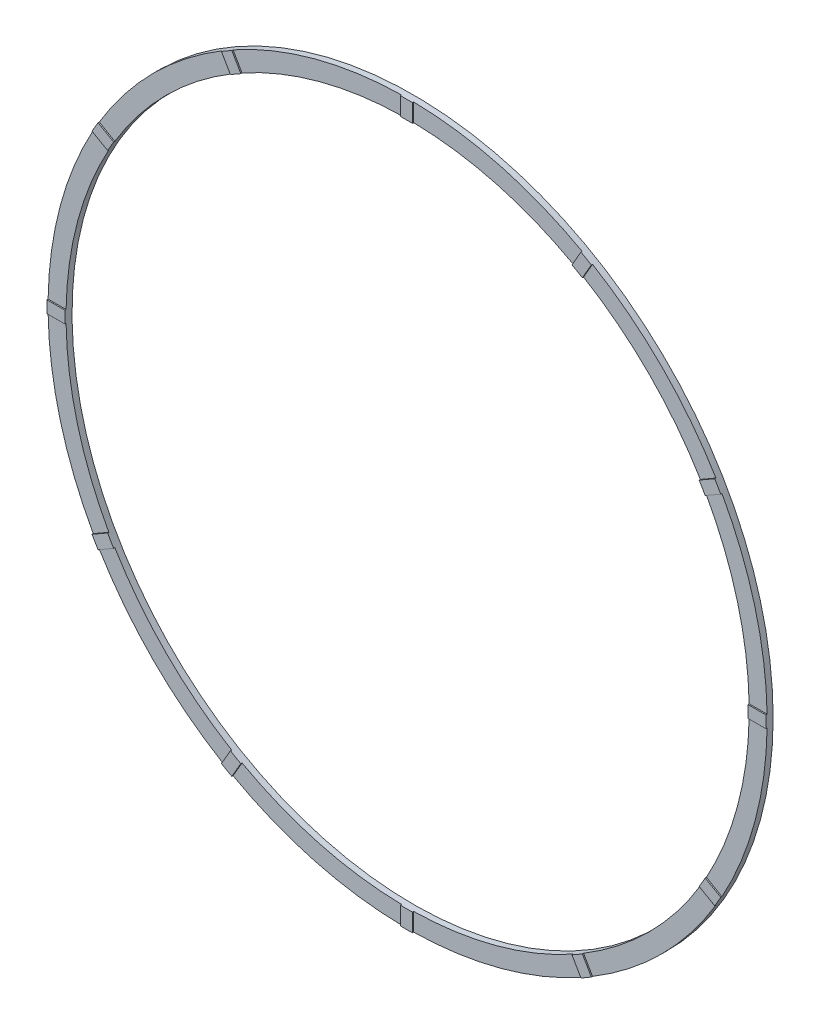
from build123d import *
from build123d.topology import SkipClean

# Parameters (mm, degrees)
SKETCH1_R           = 30
SKETCH1_R_2         = 28.5
BOSS_EXTRUDE2_DEPTH = 0.5
BOSS_EXTRUDE4_DEPTH = 0.1


with BuildPart() as part:
    # Sketch1 → Boss-Extrude2 (new body)
    with BuildSketch(Plane.XY):
        Circle(SKETCH1_R)
        Circle(SKETCH1_R_2, mode=Mode.SUBTRACT)
    extrude(amount=BOSS_EXTRUDE2_DEPTH)

    # Sketch2 → Boss-Extrude4 (add)
    with SkipClean():  # the faces are left unmerged after this step: merging them gives an invalid solid
        with BuildSketch(Plane.XY.offset(0.5)):
            with BuildLine():
                Line((14.56490382, 26.227153424), (13.814794147, 24.927925359))
                ThreePointArc((13.814794147, 24.927925359), (14.25, 24.681724008), (14.680819551, 24.427925359))
                Line((14.680819551, 24.427925359), (15.430929224, 25.727153424))
                ThreePointArc((15.430929224, 25.727153424), (15, 25.980762114), (14.56490382, 26.227153424))
            make_face()
            with BuildLine():
                Line((-0.5, 29.995833044), (-0.5, 28.495613698))
                ThreePointArc((-0.5, 28.495613698), (0, 28.5), (0.5, 28.495613698))
                Line((0.5, 28.495613698), (0.5, 29.995833044))
                ThreePointArc((0.5, 29.995833044), (0, 30), (-0.5, 29.995833044))
            make_face()
            with BuildLine():
                Line((25.727153424, 15.430929224), (24.427925359, 14.680819551))
                ThreePointArc((24.427925359, 14.680819551), (24.681724008, 14.25), (24.927925359, 13.814794147))
                Line((24.927925359, 13.814794147), (26.227153424, 14.56490382))
                ThreePointArc((26.227153424, 14.56490382), (25.980762114, 15), (25.727153424, 15.430929224))
            make_face()
            with BuildLine():
                Line((29.995833044, 0.5), (28.495613698, 0.5))
                ThreePointArc((28.495613698, 0.5), (28.5, 0), (28.495613698, -0.5))
                Line((28.495613698, -0.5), (29.995833044, -0.5))
                ThreePointArc((29.995833044, -0.5), (30, 0), (29.995833044, 0.5))
            make_face()
            with BuildLine():
                Line((26.227153424, -14.56490382), (24.927925359, -13.814794147))
                ThreePointArc((24.927925359, -13.814794147), (24.681724008, -14.25), (24.427925359, -14.680819551))
                Line((24.427925359, -14.680819551), (25.727153424, -15.430929224))
                ThreePointArc((25.727153424, -15.430929224), (25.980762114, -15), (26.227153424, -14.56490382))
            make_face()
            with BuildLine():
                Line((15.430929224, -25.727153424), (14.680819551, -24.427925359))
                ThreePointArc((14.680819551, -24.427925359), (14.25, -24.681724008), (13.814794147, -24.927925359))
                Line((13.814794147, -24.927925359), (14.56490382, -26.227153424))
                ThreePointArc((14.56490382, -26.227153424), (15, -25.980762114), (15.430929224, -25.727153424))
            make_face()
            with BuildLine():
                Line((0.5, -29.995833044), (0.5, -28.495613698))
                ThreePointArc((0.5, -28.495613698), (0, -28.5), (-0.5, -28.495613698))
                Line((-0.5, -28.495613698), (-0.5, -29.995833044))
                ThreePointArc((-0.5, -29.995833044), (0, -30), (0.5, -29.995833044))
            make_face()
            with BuildLine():
                Line((-14.56490382, -26.227153424), (-13.814794147, -24.927925359))
                ThreePointArc((-13.814794147, -24.927925359), (-14.25, -24.681724008), (-14.680819551, -24.427925359))
                Line((-14.680819551, -24.427925359), (-15.430929224, -25.727153424))
                ThreePointArc((-15.430929224, -25.727153424), (-15, -25.980762114), (-14.56490382, -26.227153424))
            make_face()
            with BuildLine():
                Line((-25.727153424, -15.430929224), (-24.427925359, -14.680819551))
                ThreePointArc((-24.427925359, -14.680819551), (-24.681724008, -14.25), (-24.927925359, -13.814794147))
                Line((-24.927925359, -13.814794147), (-26.227153424, -14.56490382))
                ThreePointArc((-26.227153424, -14.56490382), (-25.980762114, -15), (-25.727153424, -15.430929224))
            make_face()
            with BuildLine():
                Line((-29.995833044, -0.5), (-28.495613698, -0.5))
                ThreePointArc((-28.495613698, -0.5), (-28.5, 0), (-28.495613698, 0.5))
                Line((-28.495613698, 0.5), (-29.995833044, 0.5))
                ThreePointArc((-29.995833044, 0.5), (-30, 0), (-29.995833044, -0.5))
            make_face()
            with BuildLine():
                Line((-26.227153424, 14.56490382), (-24.927925359, 13.814794147))
                ThreePointArc((-24.927925359, 13.814794147), (-24.681724008, 14.25), (-24.427925359, 14.680819551))
                Line((-24.427925359, 14.680819551), (-25.727153424, 15.430929224))
                ThreePointArc((-25.727153424, 15.430929224), (-25.980762114, 15), (-26.227153424, 14.56490382))
            make_face()
            with BuildLine():
                Line((-15.430929224, 25.727153424), (-14.680819551, 24.427925359))
                ThreePointArc((-14.680819551, 24.427925359), (-14.25, 24.681724008), (-13.814794147, 24.927925359))
                Line((-13.814794147, 24.927925359), (-14.56490382, 26.227153424))
                ThreePointArc((-14.56490382, 26.227153424), (-15, 25.980762114), (-15.430929224, 25.727153424))
            make_face()
        extrude(amount=BOSS_EXTRUDE4_DEPTH)


solid = part.part
